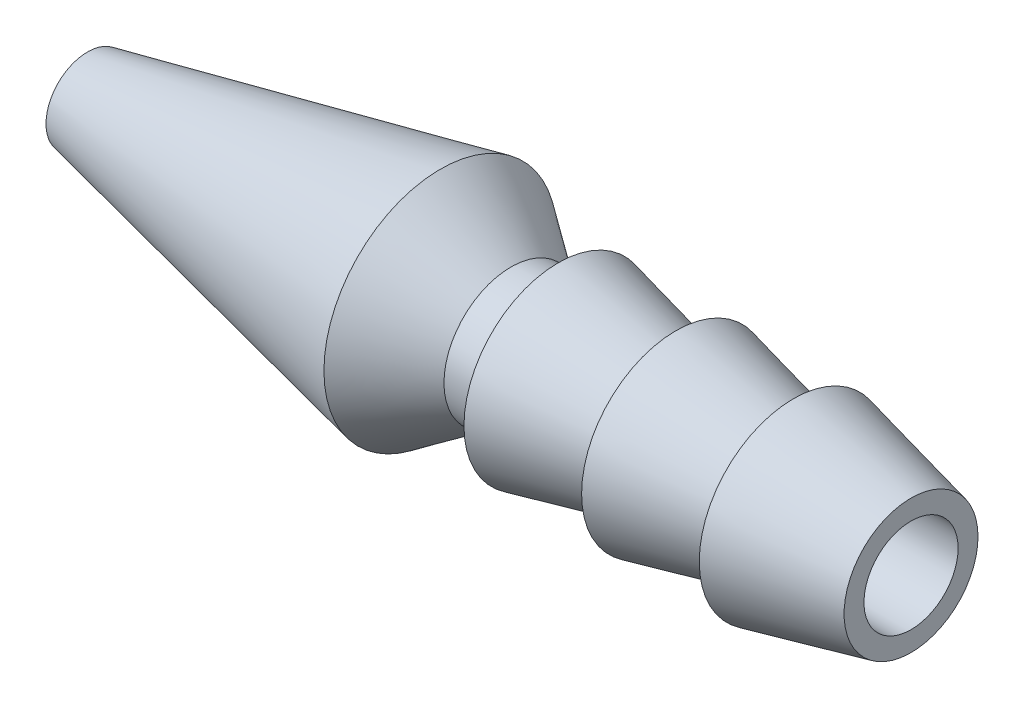
from build123d import *

# Parameters (mm, degrees)
SKETCH1_R           = 4
BOSS_EXTRUDE1_DEPTH = 5
BOSS_EXTRUDE1_TAPER = 13
SKETCH2_R           = 4
BOSS_EXTRUDE2_DEPTH = 5
BOSS_EXTRUDE2_TAPER = 13
SKETCH3_R           = 4
BOSS_EXTRUDE3_DEPTH = 5
BOSS_EXTRUDE3_TAPER = 13
SKETCH4_R           = 2.85
BOSS_EXTRUDE4_DEPTH = 2
SKETCH5_R           = 2.85
BOSS_EXTRUDE5_DEPTH = 3
BOSS_EXTRUDE5_DRAFT = -35
SKETCH6_R           = 4.950622615
BOSS_EXTRUDE6_DEPTH = 15
BOSS_EXTRUDE6_TAPER = 12
SKETCH9_R           = 2
CUT_EXTRUDE1_DEPTH  = 20


with BuildPart() as part:
    # Sketch1 → Boss-Extrude1 (new body)
    with BuildSketch(Plane(origin=(0, 0, 0), x_dir=(0, 0, -1), z_dir=(1, 0, 0))):
        Circle(SKETCH1_R)
    extrude(amount=BOSS_EXTRUDE1_DEPTH, taper=BOSS_EXTRUDE1_TAPER)

    # Sketch2 → Boss-Extrude2 (add)
    with BuildSketch(Plane(origin=(5, 0, 0), x_dir=(0, 0, -1), z_dir=(1, 0, 0))):
        Circle(SKETCH2_R)
    extrude(amount=BOSS_EXTRUDE2_DEPTH, taper=BOSS_EXTRUDE2_TAPER)

    # Sketch3 → Boss-Extrude3 (add)
    with BuildSketch(Plane(origin=(10, 0, 0), x_dir=(0, 0, -1), z_dir=(1, 0, 0))):
        Circle(SKETCH3_R)
    extrude(amount=BOSS_EXTRUDE3_DEPTH, taper=BOSS_EXTRUDE3_TAPER)

    # Sketch4 → Boss-Extrude4 (add)
    with BuildSketch(Plane.ZY):
        Circle(SKETCH4_R)
    extrude(amount=BOSS_EXTRUDE4_DEPTH)


with BuildPart() as boss_extrude5_tool:
    # Sketch5 → Boss-Extrude5 (with draft: the straight prism first)
    with BuildSketch(Plane.ZY.offset(2)):
        Circle(SKETCH5_R)
    extrude(amount=BOSS_EXTRUDE5_DEPTH)
    # Boss-Extrude5: the draft: its side faces are tilted about the plane it starts from
    boss_extrude5_sides = [boss_extrude5_tool.faces().sort_by_distance(p)[0] for p in [
        (-3.5, 0, -2.85),
    ]]
    draft(boss_extrude5_sides, Plane.ZY.offset(2), BOSS_EXTRUDE5_DRAFT)


with BuildPart() as part_1:
    add(part.part)

    # Boss-Extrude5: add boss_extrude5_tool
    add(boss_extrude5_tool.part)

    # Sketch6 → Boss-Extrude6 (add)
    with BuildSketch(Plane.ZY.offset(5)):
        Circle(SKETCH6_R)
    extrude(amount=BOSS_EXTRUDE6_DEPTH, taper=BOSS_EXTRUDE6_TAPER)

    # Sketch9 → Cut-Extrude1 (cut)
    with BuildSketch(Plane(origin=(15, 0, 0), x_dir=(0, 0, -1), z_dir=(1, 0, 0))):
        Circle(SKETCH9_R)
    extrude(amount=-CUT_EXTRUDE1_DEPTH, mode=Mode.SUBTRACT)


solid = part_1.part
